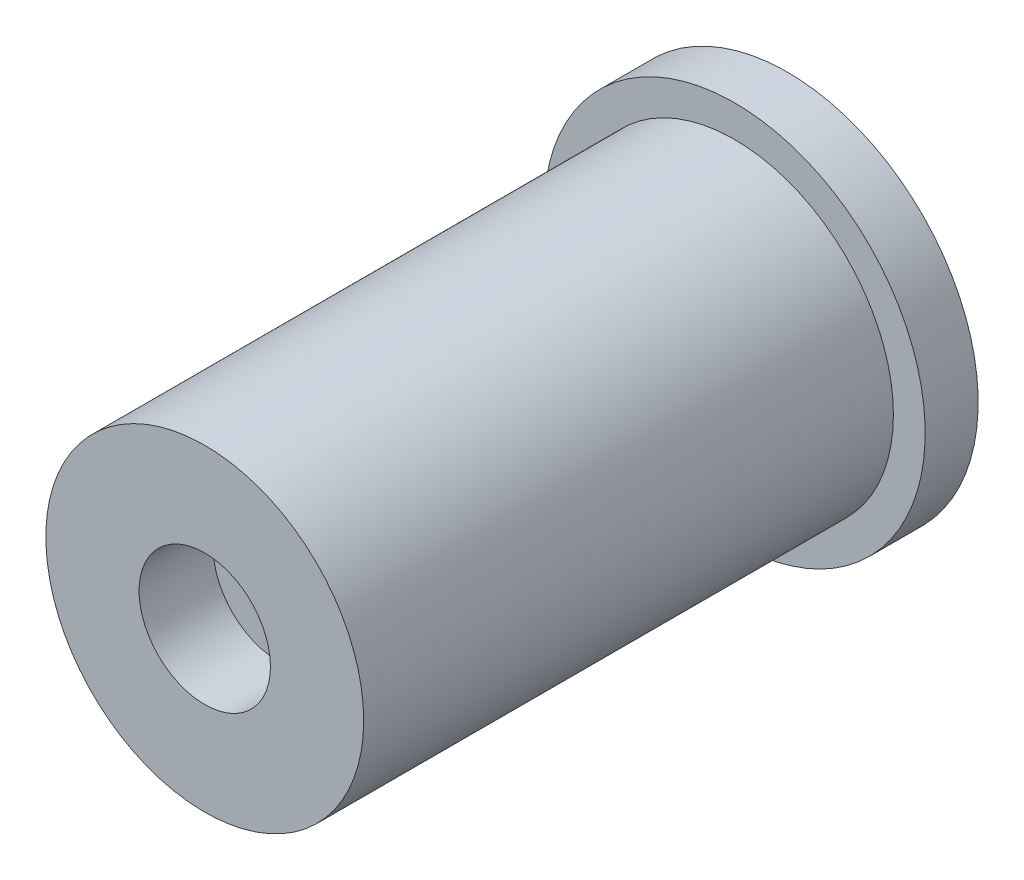
from build123d import *

# Parameters (mm, degrees)
CROQUIS1_R              = 7.5
CROQUIS1_R_2            = 1.85
SALIENTE_EXTRUIR1_DEPTH = 25
CROQUIS2_R              = 6.5
CORTAR_EXTRUIR1_DEPTH   = 7.5
CROQUIS3_R              = 9
SALIENTE_EXTRUIR2_DEPTH = 2.5
CROQUIS4_R              = 3.1
CORTAR_EXTRUIR2_DEPTH   = 3.5
CROQUIS5_R              = 3.075
CORTAR_EXTRUIR3_DEPTH   = 4
REDONDEO1_R             = 0.5
CROQUIS6_R              = 1.75
CORTAR_EXTRUIR4_DEPTH   = 3.4


with BuildPart() as part:
    # Croquis1 → Saliente-Extruir1 (new body)
    with BuildSketch(Plane.XY):
        Circle(CROQUIS1_R)
        Circle(CROQUIS1_R_2, mode=Mode.SUBTRACT)
    extrude(amount=SALIENTE_EXTRUIR1_DEPTH)

    # Croquis2 → Cortar-Extruir1 (cut, symmetric)
    with BuildSketch(Plane.XY.offset(12.5)):
        Circle(CROQUIS2_R)
    extrude(amount=CORTAR_EXTRUIR1_DEPTH, both=True, mode=Mode.SUBTRACT)

    # Croquis3 → Saliente-Extruir2 (add)
    with BuildSketch(Plane(origin=(0, 0, 0), x_dir=(-1, 0, 0), z_dir=(0, 0, -1))):
        Circle(CROQUIS3_R)
    extrude(amount=SALIENTE_EXTRUIR2_DEPTH)

    # Croquis4 → Cortar-Extruir2 (cut)
    with BuildSketch(Plane.XY.offset(25)):
        Circle(CROQUIS4_R)
    extrude(amount=-CORTAR_EXTRUIR2_DEPTH, mode=Mode.SUBTRACT)

    # Croquis5 → Cortar-Extruir3 (cut)
    with BuildSketch(Plane(origin=(0, 0, -2.5), x_dir=(-1, 0, 0), z_dir=(0, 0, -1))):
        Circle(CROQUIS5_R)
    extrude(amount=-CORTAR_EXTRUIR3_DEPTH, mode=Mode.SUBTRACT)

    # Redondeo1
    redondeo1_edges = [part.edges().sort_by_distance(p)[0] for p in [
        (3.075, 0, -2.5),
    ]]
    fillet(redondeo1_edges, radius=REDONDEO1_R)

    # Croquis6 → Cortar-Extruir4 (cut)
    with BuildSketch(Plane(origin=(0, 0, -2.5), x_dir=(-1, 0, 0), z_dir=(0, 0, -1))):
        with Locations((-5.5, 0)):
            Circle(CROQUIS6_R)
        with Locations(Location((5.5, 0, 0), (0, 0, 180))):
            Circle(CROQUIS6_R)
    extrude(amount=-CORTAR_EXTRUIR4_DEPTH, mode=Mode.SUBTRACT)


solid = part.part
